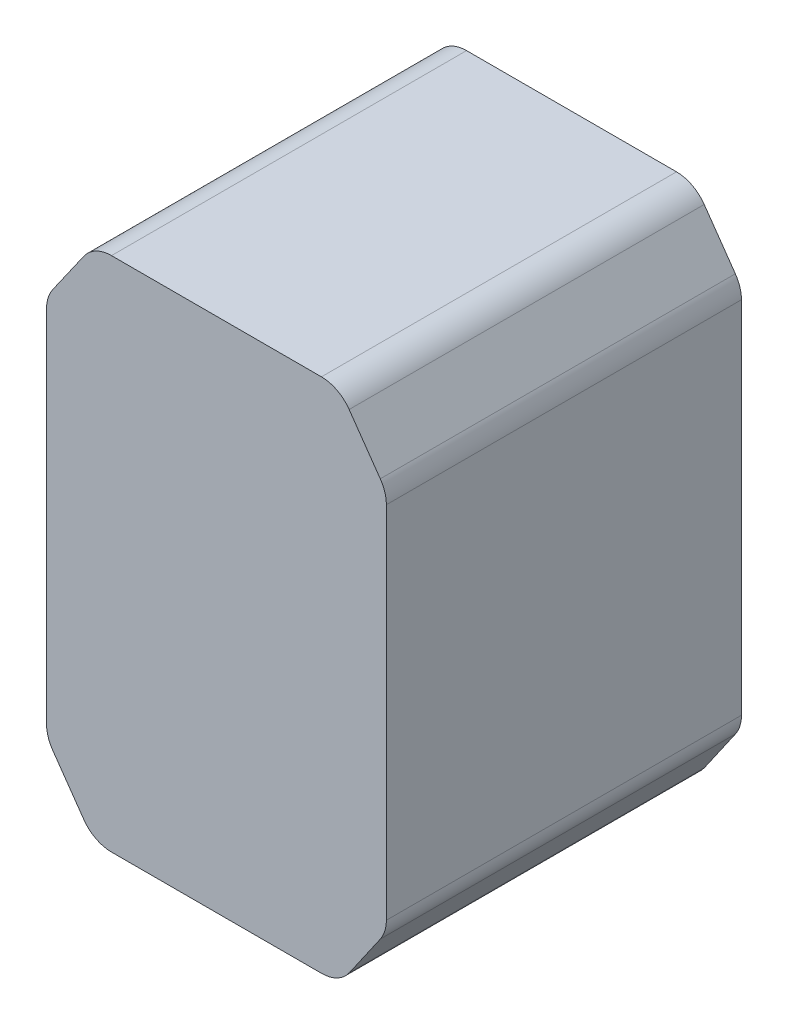
from build123d import *

# Parameters (mm, degrees)
SKETCH1_W               = 40.2
SKETCH1_H               = 61.1
BOSS_EXTRUDE1_DEPTH     = 21
CUT_EXTRUDE_THIN1_DEPTH = 42


with BuildPart() as part:
    # Sketch1 → Boss-Extrude1 (new, symmetric)
    with BuildSketch(Plane.XY):
        Rectangle(SKETCH1_W, SKETCH1_H)
    extrude(amount=BOSS_EXTRUDE1_DEPTH, both=True)

    # Sketch2 → Cut-Extrude-Thin1 (cut)
    with BuildSketch(Plane.XY.offset(21)):
        with BuildLine():
            Line((12.43954262, -40.55), (-12.417377754, -40.55))
            ThreePointArc((-12.417377754, -40.55), (-18.882723085, -38.967701468), (-23.886624641, -34.578472821))
            Line((-23.886624641, -34.578472821), (-27.569246887, -29.317583898))
            ThreePointArc((-27.569246887, -29.317583898), (-29.452330441, -25.498062465), (-30.1, -21.289111077))
            Line((-30.1, -21.289111077), (-30.1, 0))
            Line((-30.1, 0), (-30.1, 21.289111077))
            ThreePointArc((-30.1, 21.289111077), (-29.452330441, 25.498062465), (-27.569246887, 29.317583898))
            Line((-27.569246887, 29.317583898), (-23.886624641, 34.578472821))
            ThreePointArc((-23.886624641, 34.578472821), (-18.882723085, 38.967701468), (-12.417377754, 40.55))
            Line((-12.417377754, 40.55), (12.417377754, 40.55))
            ThreePointArc((12.417377754, 40.55), (18.882723085, 38.967701468), (23.886624641, 34.578472821))
            Line((23.886624641, 34.578472821), (27.569246887, 29.317583898))
            ThreePointArc((27.569246887, 29.317583898), (29.452330441, 25.498062465), (30.1, 21.289111077))
            Line((30.1, 21.289111077), (30.1, 0))
            Line((30.1, 0), (30.1, -21.273665037))
            ThreePointArc((30.1, -21.273665037), (29.461154338, -25.454520783), (27.602920748, -29.253816306))
            Line((27.602920748, -29.253816306), (23.942463367, -34.530151269))
            ThreePointArc((23.942463367, -34.530151269), (18.930994007, -38.954074286), (12.43954262, -40.55))
        make_face()
        with BuildLine():
            Line((12.43954262, -30.55), (-12.417377754, -30.55))
            ThreePointArc((-12.417377754, -30.55), (-14.264619277, -30.097914705), (-15.694305436, -28.843849377))
            Line((-15.694305436, -28.843849377), (-19.376927682, -23.582960454))
            ThreePointArc((-19.376927682, -23.582960454), (-19.914951555, -22.491668616), (-20.1, -21.289111077))
            Line((-20.1, -21.289111077), (-20.1, 0))
            Line((-20.1, 0), (-20.1, 21.289111077))
            ThreePointArc((-20.1, 21.289111077), (-19.914951555, 22.491668616), (-19.376927682, 23.582960454))
            Line((-19.376927682, 23.582960454), (-15.694305436, 28.843849377))
            ThreePointArc((-15.694305436, 28.843849377), (-14.264619277, 30.097914705), (-12.417377754, 30.55))
            Line((-12.417377754, 30.55), (12.417377754, 30.55))
            ThreePointArc((12.417377754, 30.55), (14.264619277, 30.097914705), (15.694305436, 28.843849377))
            Line((15.694305436, 28.843849377), (19.376927682, 23.582960454))
            ThreePointArc((19.376927682, 23.582960454), (19.914951555, 22.491668616), (20.1, 21.289111077))
            Line((20.1, 21.289111077), (20.1, 0))
            Line((20.1, 0), (20.1, -21.273665037))
            ThreePointArc((20.1, -21.273665037), (19.917472668, -22.46819525), (19.386548785, -23.553708257))
            Line((19.386548785, -23.553708257), (15.726091405, -28.83004322))
            ThreePointArc((15.726091405, -28.83004322), (14.294243016, -30.094021224), (12.43954262, -30.55))
        make_face(mode=Mode.SUBTRACT)
    extrude(amount=-CUT_EXTRUDE_THIN1_DEPTH, mode=Mode.SUBTRACT)


solid = part.part
